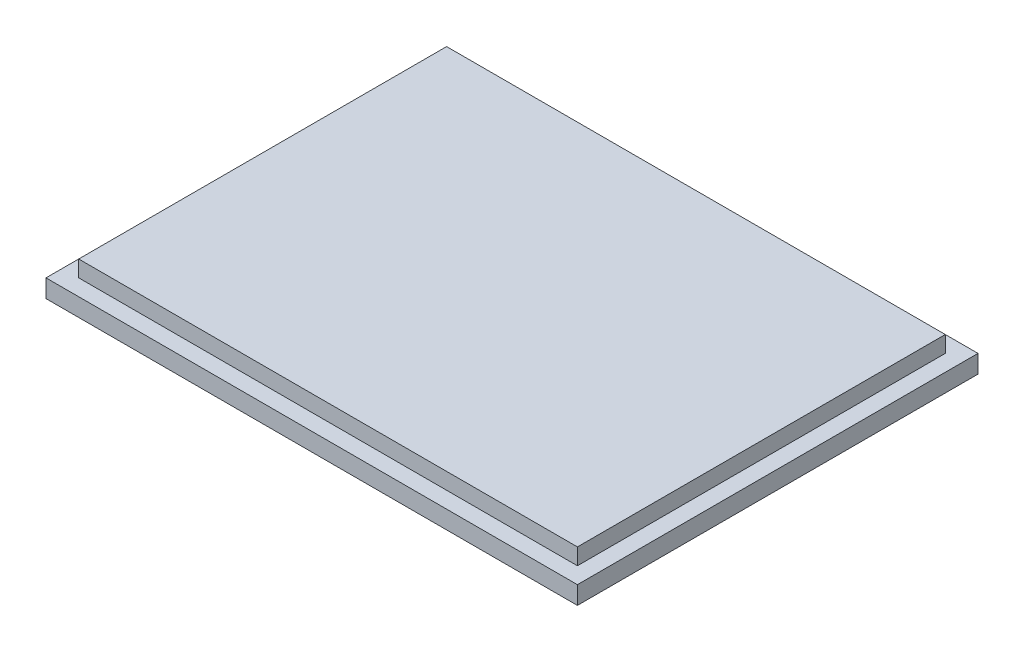
from build123d import *

# Parameters (mm, degrees)
SKETCH1_W           = 325
SKETCH1_H           = 245
BOSS_EXTRUDE1_DEPTH = 11
SKETCH2_W           = 305
SKETCH2_H           = 225
BOSS_EXTRUDE2_DEPTH = 10


with BuildPart() as part:
    # Sketch1 → Boss-Extrude1 (new body)
    with BuildSketch(Plane(origin=(0, 0, 0), x_dir=(1, 0, 0), z_dir=(0, 1, 0))):
        Rectangle(SKETCH1_W, SKETCH1_H)
    extrude(amount=BOSS_EXTRUDE1_DEPTH)

    # Sketch2 → Boss-Extrude2 (add)
    with BuildSketch(Plane(origin=(0, 11, 0), x_dir=(1, 0, 0), z_dir=(0, 1, 0))):
        Rectangle(SKETCH2_W, SKETCH2_H)
    extrude(amount=BOSS_EXTRUDE2_DEPTH)


solid = part.part
